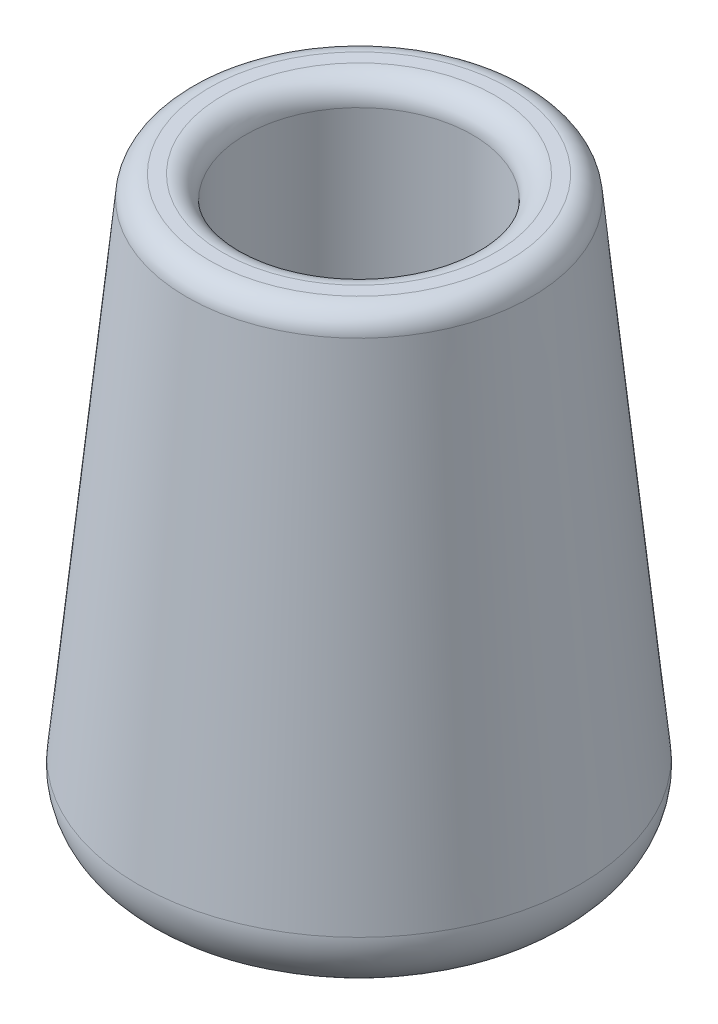
from build123d import *

# Parameters (mm, degrees)
SKETCH2_R               = 15
SKETCH1_R               = 20
CUT_EXTRUDE1_DEPTH      = 58.445626622
CUT_EXTRUDE1_DEPTH_BACK = 20
SKETCH3_R               = 10
FILLET1_R               = 5
FILLET2_R               = 2


with BuildPart() as part:
    # Sketch2 → Loft1 section 0
    with BuildSketch(Plane(origin=(0, 50, 0), x_dir=(1, 0, 0), z_dir=(0, 1, 0))):
        Circle(SKETCH2_R)
    # Sketch1 → Loft1 section 1
    with BuildSketch(Plane(origin=(0, 0, 0), x_dir=(1, 0, 0), z_dir=(0, 1, 0))):
        Circle(SKETCH1_R)
    loft()

    # Sketch3 → Cut-Extrude1 (cut, two sides: drawn at the far end of the back side and taken through both)
    with BuildSketch(Plane(origin=(0, 50, 0), x_dir=(1, 0, 0), z_dir=(0, 1, 0)).offset(-CUT_EXTRUDE1_DEPTH_BACK)):
        with Locations(Location((0, 0, 0), (0, 0, 270))):
            Circle(SKETCH3_R)
    extrude(amount=CUT_EXTRUDE1_DEPTH + CUT_EXTRUDE1_DEPTH_BACK, mode=Mode.SUBTRACT)

    # Fillet1
    fillet1_edges = [part.edges().sort_by_distance(p)[0] for p in [
        (-20, 0, 0),
    ]]
    fillet(fillet1_edges, radius=FILLET1_R)

    # Fillet2
    fillet2_edges = [part.edges().sort_by_distance(p)[0] for p in [
        (-15, 50, 0),
        (0, 50, -10),
    ]]
    fillet(fillet2_edges, radius=FILLET2_R)


solid = part.part
